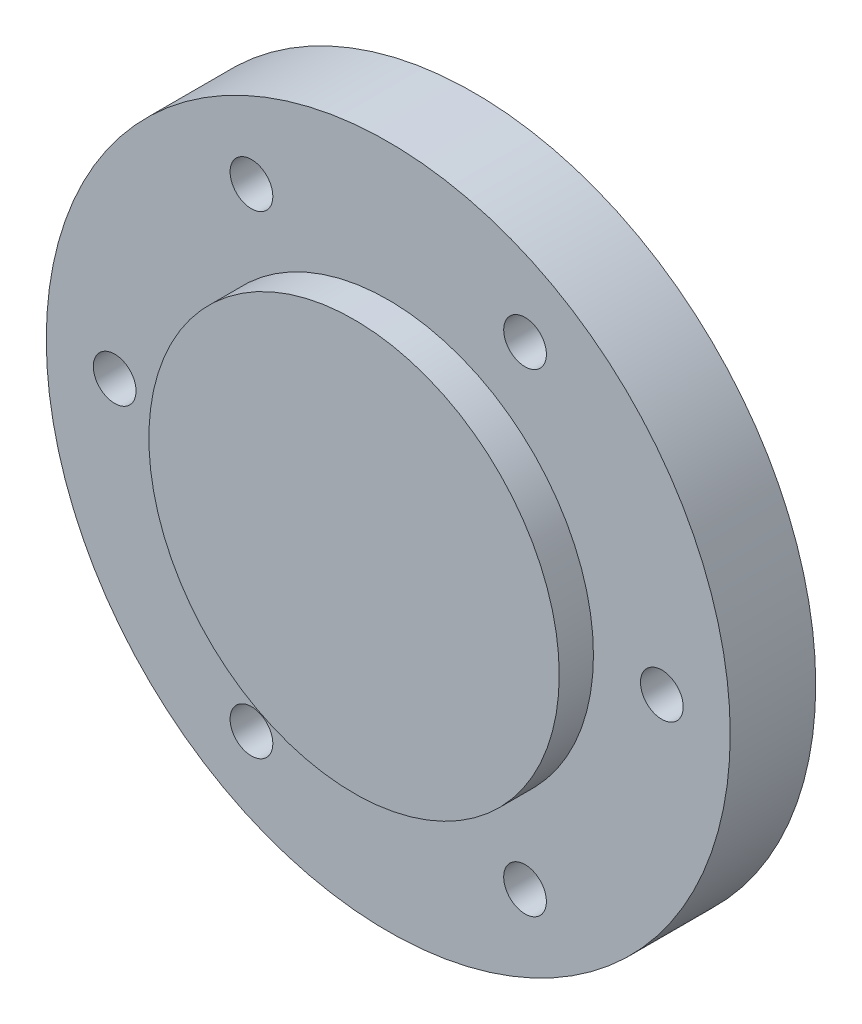
from build123d import *

# Parameters (mm, degrees)
SK_DISC_R                 = 20
OUTPUT_DISC_DEPTH         = 5
SK_PILOT_R                = 12
PILOT_BOSS_DEPTH          = 2
SK_OUTHOLE_R              = 1.25
OUTPUT_TAPPED_HOLE_DEPTH  = 5
OUTPUT_HOLE_PATTERN_COUNT = 6


with BuildPart() as part:
    # SK_Disc → Output_Disc (new body)
    with BuildSketch(Plane.XY):
        Circle(SK_DISC_R)
    extrude(amount=OUTPUT_DISC_DEPTH)

    # SK_Pilot → Pilot_Boss (add)
    with BuildSketch(Plane.XY.offset(5)):
        Circle(SK_PILOT_R)
    extrude(amount=PILOT_BOSS_DEPTH)

    # SK_OutHole → Output_Tapped_Hole (cut)
    with BuildSketch(Plane.XY.offset(5)):
        with Locations((16, 0)):
            Circle(SK_OUTHOLE_R)
    output_tapped_hole = extrude(amount=-OUTPUT_TAPPED_HOLE_DEPTH, mode=Mode.SUBTRACT)

    # Output_Hole_Pattern: Output_Tapped_Hole ×6 about axis
    output_hole_pattern_axis = Axis((0, 0, -0.35), (0, 0, 1))
    for i in range(1, OUTPUT_HOLE_PATTERN_COUNT):
        add(output_tapped_hole.rotate(output_hole_pattern_axis, i * 360 / OUTPUT_HOLE_PATTERN_COUNT), mode=Mode.SUBTRACT)


solid = part.part
